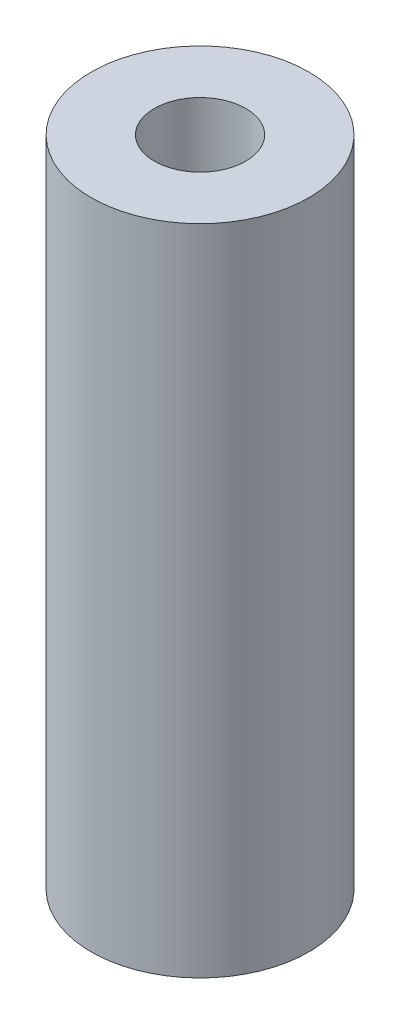
from build123d import *

# Parameters (mm, degrees)
SKETCH1_R           = 6.35
SKETCH1_R_2         = 2.667
BOSS_EXTRUDE1_DEPTH = 38.1


with BuildPart() as part:
    # Sketch1 → Boss-Extrude1 (new body)
    with BuildSketch(Plane(origin=(0, 0, 0), x_dir=(1, 0, 0), z_dir=(0, 1, 0))):
        with Locations(Location((0, 0, 0), (0, 0, 90))):
            Circle(SKETCH1_R)
        with Locations(Location((0, 0, 0), (0, 0, 90))):
            Circle(SKETCH1_R_2, mode=Mode.SUBTRACT)
    extrude(amount=BOSS_EXTRUDE1_DEPTH)


solid = part.part
